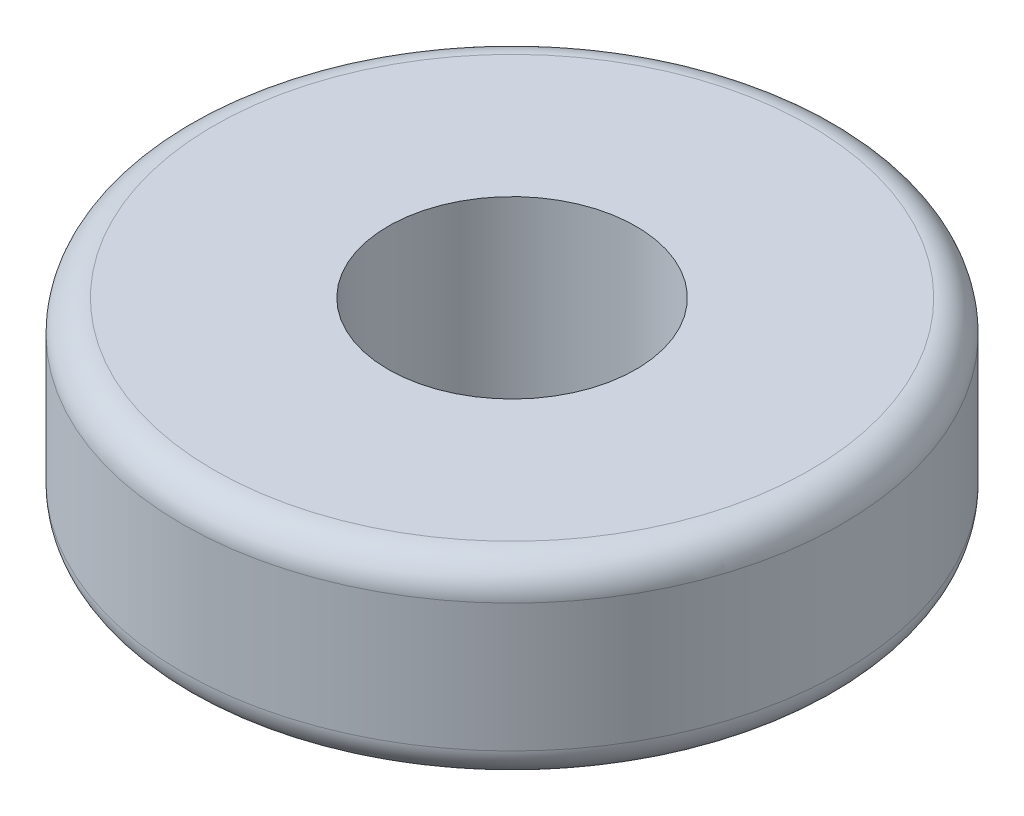
from build123d import *

# Parameters (mm, degrees)
SKETCH2_R           = 10.5
SKETCH2_R_2         = 3.95
BOSS_EXTRUDE1_DEPTH = 6.08
FILLET1_R           = 1


with BuildPart() as part:
    # Sketch2 → Boss-Extrude1 (new body)
    with BuildSketch(Plane(origin=(0, 0, 0), x_dir=(1, 0, 0), z_dir=(0, 1, 0))):
        with Locations(Location((0, 0, 0), (0, 0, 270))):
            Circle(SKETCH2_R)
        with Locations(Location((0, 0, 0), (0, 0, 270))):
            Circle(SKETCH2_R_2, mode=Mode.SUBTRACT)
    extrude(amount=BOSS_EXTRUDE1_DEPTH)

    # Fillet1
    fillet1_edges = [part.edges().sort_by_distance(p)[0] for p in [
        (0, 0, -10.5),
        (0, 6.08, -10.5),
    ]]
    fillet(fillet1_edges, radius=FILLET1_R)


solid = part.part
